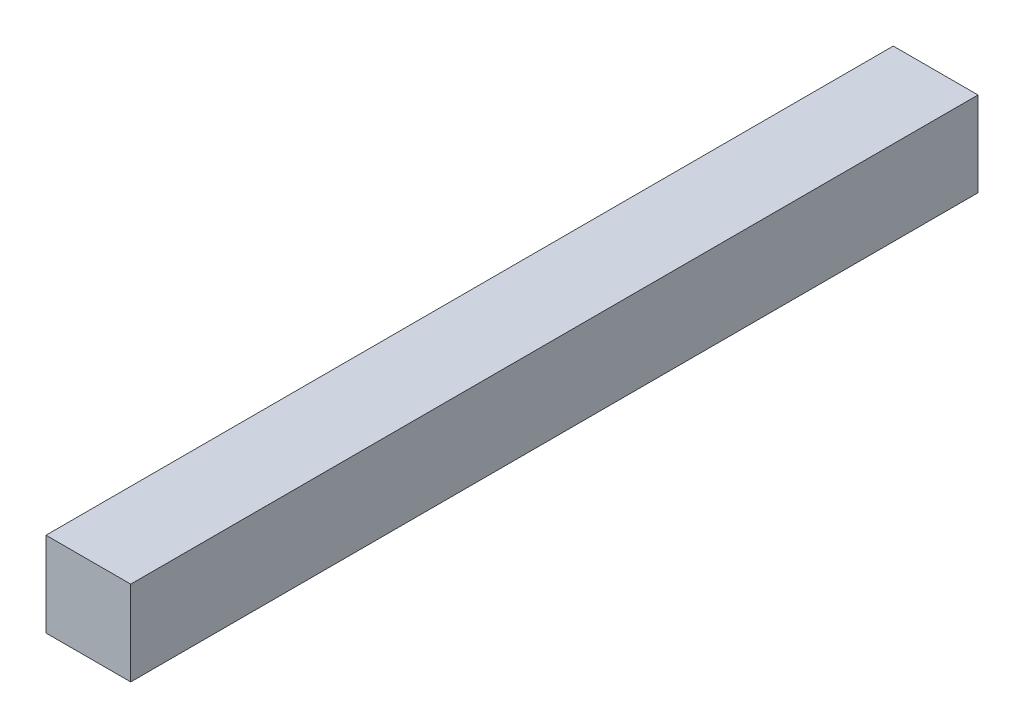
from build123d import *

# Parameters (mm, degrees)
SKETCH1_W           = 20
SKETCH1_H           = 20
BOSS_EXTRUDE1_DEPTH = 200


with BuildPart() as part:
    # Sketch1 → Boss-Extrude1 (new body)
    with BuildSketch(Plane.XY):
        with Locations((10, -10)):
            Rectangle(SKETCH1_W, SKETCH1_H)
    extrude(amount=BOSS_EXTRUDE1_DEPTH)


solid = part.part
